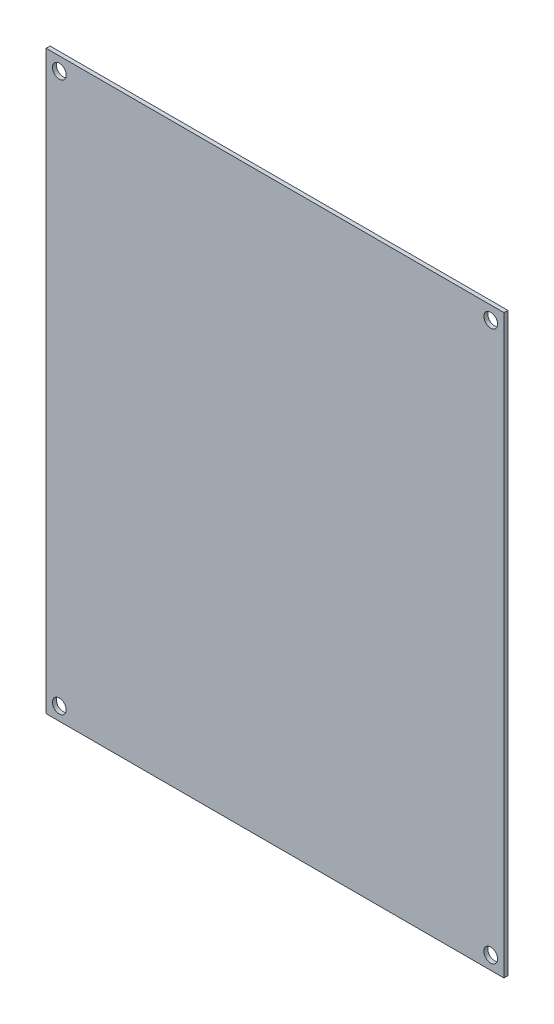
from build123d import *

# Parameters (mm, degrees)
SKETCH1_W           = 116
SKETCH1_H           = 146
SKETCH1_R           = 1.75
BOSS_EXTRUDE1_DEPTH = 1


with BuildPart() as part:
    # Sketch1 → Boss-Extrude1 (new body)
    with BuildSketch(Plane.XY):
        Rectangle(SKETCH1_W, SKETCH1_H)
        with Locations((-54.65, 69.65)):
            Circle(SKETCH1_R, mode=Mode.SUBTRACT)
        with Locations((54.65, 69.65)):
            Circle(SKETCH1_R, mode=Mode.SUBTRACT)
        with Locations((54.65, -69.65)):
            Circle(SKETCH1_R, mode=Mode.SUBTRACT)
        with Locations((-54.65, -69.65)):
            Circle(SKETCH1_R, mode=Mode.SUBTRACT)
    extrude(amount=BOSS_EXTRUDE1_DEPTH)


solid = part.part
